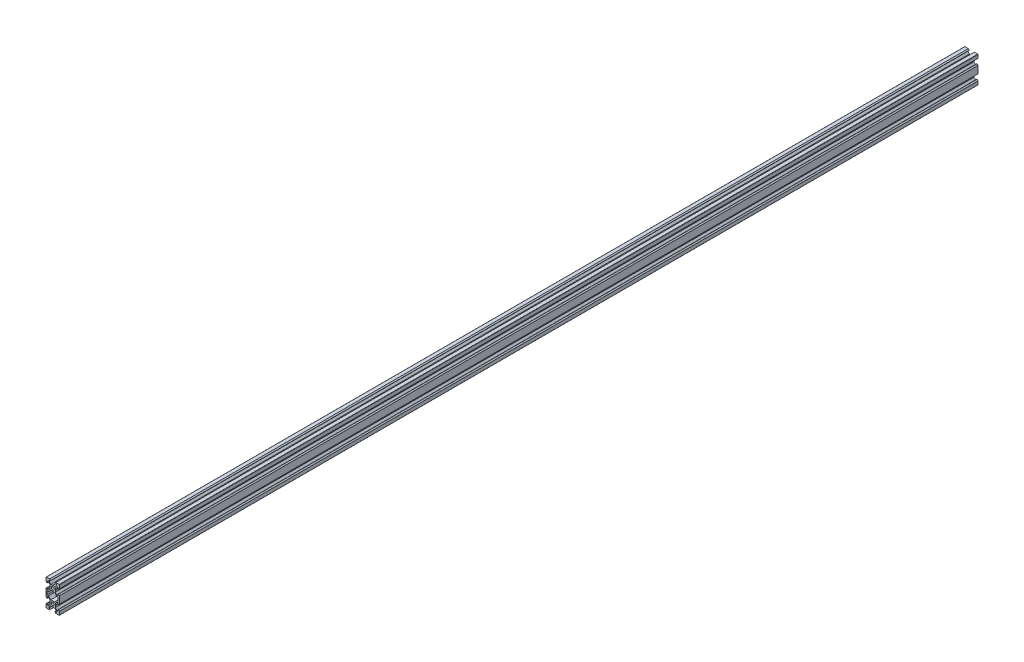
from build123d import *

# Parameters (mm, degrees)
SKETCH1_R           = 2.1
BOSS_EXTRUDE1_DEPTH = 1371.6


with BuildPart() as part:
    # Sketch1 → Boss-Extrude1 (new body)
    with BuildSketch(Plane.XY):
        with BuildLine():
            Line((4.58, -20), (9.5, -20))
            ThreePointArc((9.5, -20), (9.853553391, -19.853553391), (10, -19.5))
            Line((10, -19.5), (10, -14.58))
            Line((10, -14.58), (8.545, -13.125))
            Line((8.545, -13.125), (8.2, -13.125))
            Line((8.2, -13.125), (8.2, -15.5))
            Line((8.2, -15.5), (6.560660172, -15.5))
            Line((6.560660172, -15.5), (3.9, -12.839339828))
            Line((3.9, -12.839339828), (3.9, -10.21))
            Line((3.9, -10.21), (3.69, -10))
            Line((3.69, -10), (3.9, -9.79))
            Line((3.9, -9.79), (3.9, -7.160660172))
            Line((3.9, -7.160660172), (6.560660172, -4.5))
            Line((6.560660172, -4.5), (8.2, -4.5))
            Line((8.2, -4.5), (8.2, -6.875))
            Line((8.2, -6.875), (8.545, -6.875))
            Line((8.545, -6.875), (10, -5.42))
            Line((10, -5.42), (10, 5.42))
            Line((10, 5.42), (8.545, 6.875))
            Line((8.545, 6.875), (8.2, 6.875))
            Line((8.2, 6.875), (8.2, 4.5))
            Line((8.2, 4.5), (6.560660172, 4.5))
            Line((6.560660172, 4.5), (3.9, 7.160660172))
            Line((3.9, 7.160660172), (3.9, 9.79))
            Line((3.9, 9.79), (3.69, 10))
            Line((3.69, 10), (3.9, 10.21))
            Line((3.9, 10.21), (3.9, 12.839339828))
            Line((3.9, 12.839339828), (6.560660172, 15.5))
            Line((6.560660172, 15.5), (8.2, 15.5))
            Line((8.2, 15.5), (8.2, 13.125))
            Line((8.2, 13.125), (8.545, 13.125))
            Line((8.545, 13.125), (10, 14.58))
            Line((10, 14.58), (10, 19.5))
            ThreePointArc((10, 19.5), (9.853553391, 19.853553391), (9.5, 20))
            Line((9.5, 20), (4.58, 20))
            Line((4.58, 20), (3.125, 18.545))
            Line((3.125, 18.545), (3.125, 18.2))
            Line((3.125, 18.2), (5.5, 18.2))
            Line((5.5, 18.2), (5.5, 16.560660172))
            Line((5.5, 16.560660172), (2.839339828, 13.9))
            Line((2.839339828, 13.9), (0.21, 13.9))
            Line((0.21, 13.9), (0, 13.69))
            Line((0, 13.69), (-0.21, 13.9))
            Line((-0.21, 13.9), (-2.839339828, 13.9))
            Line((-2.839339828, 13.9), (-5.5, 16.560660172))
            Line((-5.5, 16.560660172), (-5.5, 18.2))
            Line((-5.5, 18.2), (-3.125, 18.2))
            Line((-3.125, 18.2), (-3.125, 18.545))
            Line((-3.125, 18.545), (-4.58, 20))
            Line((-4.58, 20), (-9.5, 20))
            ThreePointArc((-9.5, 20), (-9.853553391, 19.853553391), (-10, 19.5))
            Line((-10, 19.5), (-10, 14.58))
            Line((-10, 14.58), (-8.545, 13.125))
            Line((-8.545, 13.125), (-8.2, 13.125))
            Line((-8.2, 13.125), (-8.2, 15.5))
            Line((-8.2, 15.5), (-6.560660172, 15.5))
            Line((-6.560660172, 15.5), (-3.9, 12.839339828))
            Line((-3.9, 12.839339828), (-3.9, 10.21))
            Line((-3.9, 10.21), (-3.69, 10))
            Line((-3.69, 10), (-3.9, 9.79))
            Line((-3.9, 9.79), (-3.9, 7.160660172))
            Line((-3.9, 7.160660172), (-6.560660172, 4.5))
            Line((-6.560660172, 4.5), (-8.2, 4.5))
            Line((-8.2, 4.5), (-8.2, 6.875))
            Line((-8.2, 6.875), (-8.545, 6.875))
            Line((-8.545, 6.875), (-10, 5.42))
            Line((-10, 5.42), (-10, -5.42))
            Line((-10, -5.42), (-8.545, -6.875))
            Line((-8.545, -6.875), (-8.2, -6.875))
            Line((-8.2, -6.875), (-8.2, -4.5))
            Line((-8.2, -4.5), (-6.560660172, -4.5))
            Line((-6.560660172, -4.5), (-3.9, -7.160660172))
            Line((-3.9, -7.160660172), (-3.9, -9.79))
            Line((-3.9, -9.79), (-3.69, -10))
            Line((-3.69, -10), (-3.9, -10.21))
            Line((-3.9, -10.21), (-3.9, -12.839339828))
            Line((-3.9, -12.839339828), (-6.560660172, -15.5))
            Line((-6.560660172, -15.5), (-8.2, -15.5))
            Line((-8.2, -15.5), (-8.2, -13.125))
            Line((-8.2, -13.125), (-8.545, -13.125))
            Line((-8.545, -13.125), (-10, -14.58))
            Line((-10, -14.58), (-10, -19.5))
            ThreePointArc((-10, -19.5), (-9.853553391, -19.853553391), (-9.5, -20))
            Line((-9.5, -20), (-4.58, -20))
            Line((-4.58, -20), (-3.125, -18.545))
            Line((-3.125, -18.545), (-3.125, -18.2))
            Line((-3.125, -18.2), (-5.5, -18.2))
            Line((-5.5, -18.2), (-5.5, -16.560660172))
            Line((-5.5, -16.560660172), (-2.839339828, -13.9))
            Line((-2.839339828, -13.9), (-0.21, -13.9))
            Line((-0.21, -13.9), (0, -13.69))
            Line((0, -13.69), (0.21, -13.9))
            Line((0.21, -13.9), (2.839339828, -13.9))
            Line((2.839339828, -13.9), (5.5, -16.560660172))
            Line((5.5, -16.560660172), (5.5, -18.2))
            Line((5.5, -18.2), (3.125, -18.2))
            Line((3.125, -18.2), (3.125, -18.545))
            Line((3.125, -18.545), (4.58, -20))
        make_face()
        with Locations((0, -10)):
            Circle(SKETCH1_R, mode=Mode.SUBTRACT)
        Polygon((-6.239339828, -2.7), (-8.2, -2.7), (-8.2, 2.7), (-6.239339828, 2.7), (-2.839339828, 6.1), (2.839339828, 6.1), (6.239339828, 2.7), (8.2, 2.7), (8.2, -2.7), (6.239339828, -2.7), (2.839339828, -6.1), (-2.839339828, -6.1), align=None, mode=Mode.SUBTRACT)
        with Locations((0, 10)):
            Circle(SKETCH1_R, mode=Mode.SUBTRACT)
    extrude(amount=BOSS_EXTRUDE1_DEPTH)


solid = part.part
